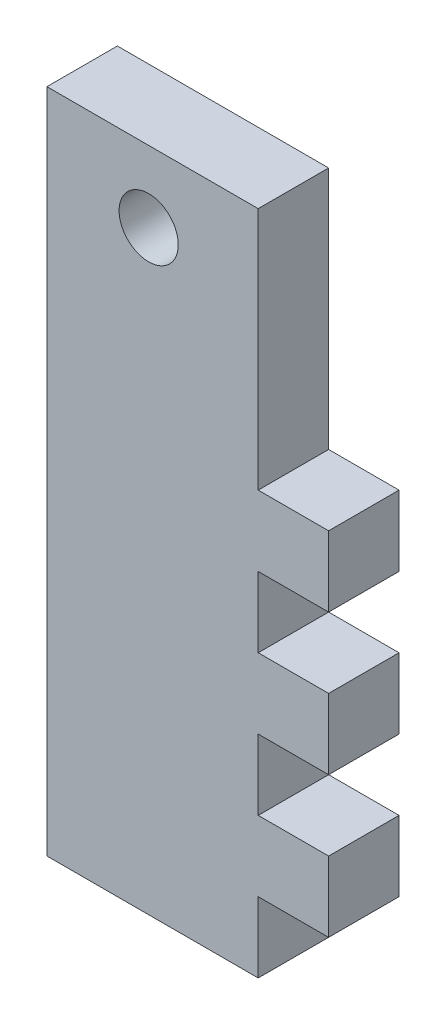
from build123d import *

# Parameters (mm, degrees)
ESQUISSE1_R        = 2.1
BOSS_EXTRU_1_DEPTH = 5


with BuildPart() as part:
    # Esquisse1 → Boss.-Extru.1 (new body)
    with BuildSketch(Plane.XY):
        Polygon((12.553066357, 2.373552168), (12.553066357, 7.929110193), (12.553066357, 19.683552168), (-2.446933643, 19.683552168), (-2.446933643, -27.626447832), (12.553066357, -27.626447832), (12.553066357, -22.626447832), (17.553066357, -22.626447832), (17.553066357, -17.626447832), (12.553066357, -17.626447832), (12.553066357, -12.626447832), (17.553066357, -12.626447832), (17.553066357, -7.626447832), (12.553066357, -7.626447832), (12.553066357, -2.626447832), (17.553066357, -2.626447832), (17.553066357, 2.373552168), align=None)
        with Locations((4.775285122, 14.620787167)):
            Circle(ESQUISSE1_R, mode=Mode.SUBTRACT)
    extrude(amount=BOSS_EXTRU_1_DEPTH)


solid = part.part
